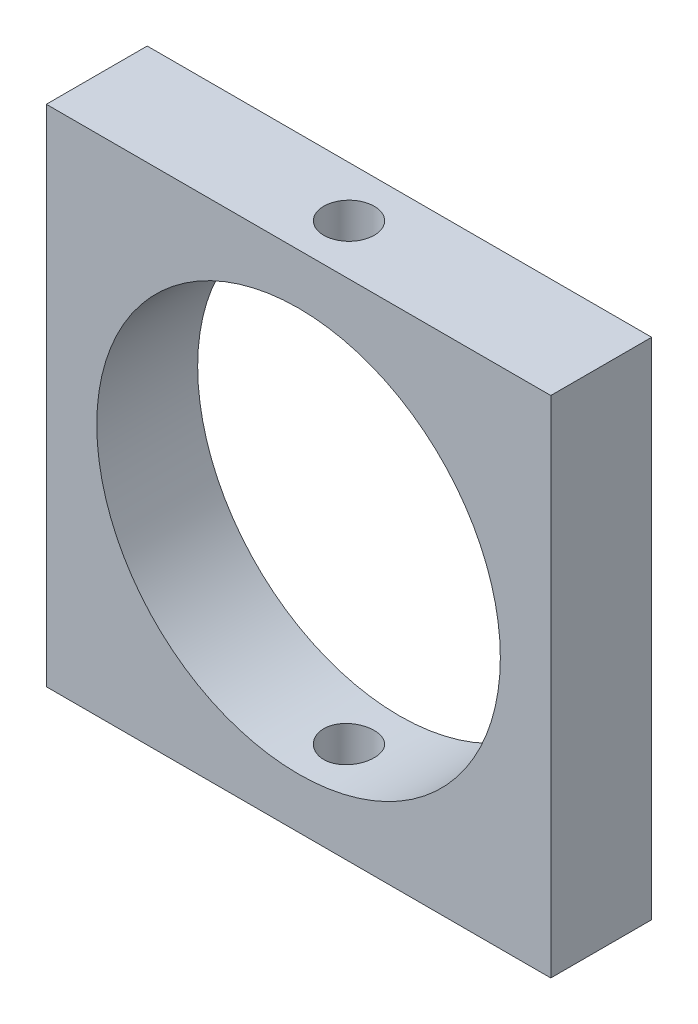
from build123d import *

# Parameters (mm, degrees)
SKETCH1_W           = 20
SKETCH1_H           = 20
SKETCH1_R           = 8
BOSS_EXTRUDE1_DEPTH = 4
SKETCH3_R           = 1
CUT_EXTRUDE1_DEPTH  = 20


with BuildPart() as part:
    # Sketch1 → Boss-Extrude1 (new body)
    with BuildSketch(Plane.XY):
        Rectangle(SKETCH1_W, SKETCH1_H)
        Circle(SKETCH1_R, mode=Mode.SUBTRACT)
    extrude(amount=BOSS_EXTRUDE1_DEPTH)

    # Sketch3 → Cut-Extrude1 (cut)
    with BuildSketch(Plane(origin=(0, 10, 0), x_dir=(1, 0, 0), z_dir=(0, 1, 0))):
        with Locations(Location((0, -2, 0), (0, 0, 270))):
            Circle(SKETCH3_R)
    extrude(amount=-CUT_EXTRUDE1_DEPTH, mode=Mode.SUBTRACT)


solid = part.part
